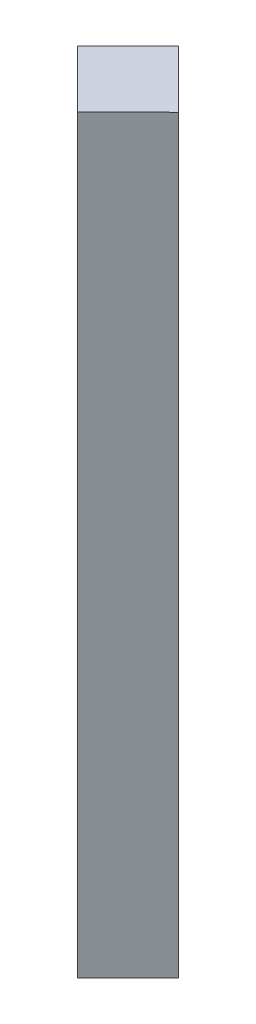
from build123d import *

# Parameters (mm, degrees)
BOSS_EXTRUDE1_DEPTH      = 30.3
BOSS_EXTRUDE1_DEPTH_BACK = 9.5
SKETCH4_R                = 0.8


with BuildPart() as part:
    # Sketch1 → Boss-Extrude1 (new, two sides: drawn at the far end of the back side and taken through both)
    with BuildSketch(Plane(origin=(0, 0, 0), x_dir=(1, 0, 0), z_dir=(0, 1, 0)).offset(-BOSS_EXTRUDE1_DEPTH_BACK)):
        Polygon((0.170807804, -2.864144671), (-2.863407818, 0.182744818), (-0.170807804, 2.864144671), (2.863407818, -0.182744818), align=None)
    extrude(amount=BOSS_EXTRUDE1_DEPTH + BOSS_EXTRUDE1_DEPTH_BACK)

    # Cut-Sweep1: sweep along a path in Sketch2
    with BuildLine(Plane(origin=(0, 0, 0), x_dir=(0.7056315400669045, 0, 0.7085789509030087), z_dir=(-0.7085789509030087, 0, 0.7056315400669045))) as cut_sweep1_path:
        Line((0, -9.5), (0, 20.2))
        ThreePointArc((0, 20.2), (-0.527207794, 21.472792206), (-1.8, 22))
        Line((-1.8, 22), (-2.25, 22))
    # Sketch4 → Cut-Sweep1 (sweep, cut)
    with BuildSketch(Plane.XZ.offset(9.5)):
        Circle(SKETCH4_R)
    sweep(path=cut_sweep1_path.line, mode=Mode.SUBTRACT)


solid = part.part
